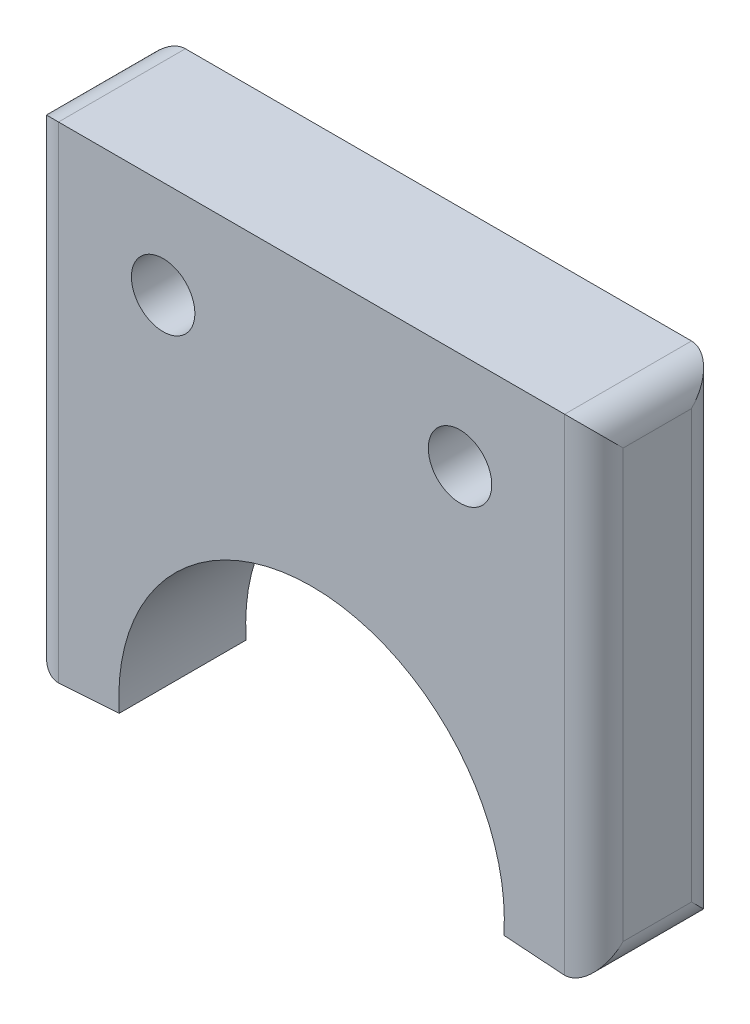
from build123d import *

# Parameters (mm, degrees)
SKETCH2_R           = 3.25
BOSS_EXTRUDE1_DEPTH = 13
FILLET1_R           = 3


with BuildPart() as part:
    # Sketch2 → Boss-Extrude1 (new body)
    with BuildSketch(Plane.XY):
        with BuildLine():
            Line((-19.701889993, -1.377690356), (-28.929357458, -2.022937739))
            Line((-28.929357458, -2.022937739), (-28.929357458, 47.977062261))
            Line((-28.929357458, 47.977062261), (28.929357458, 47.977062261))
            Line((28.929357458, 47.977062261), (28.929357458, -2.022937739))
            Line((28.929357458, -2.022937739), (19.701889993, -1.377690356))
            ThreePointArc((19.701889993, -1.377690356), (0, 19.75), (-19.701889993, -1.377690356))
        make_face()
        with Locations(Location((15.209921646, 37.977062261, 0), (0, 0, 180))):
            Circle(SKETCH2_R, mode=Mode.SUBTRACT)
        with Locations(Location((-15.209921646, 37.977062261, 0), (0, 0, 180))):
            Circle(SKETCH2_R, mode=Mode.SUBTRACT)
    extrude(amount=BOSS_EXTRUDE1_DEPTH)

    # Fillet1
    fillet1_edges = [part.edges().sort_by_distance(p)[0] for p in [
        (28.929357458, 22.977062261, 13),
        (-28.929357458, -2.022937739, 6.5),
        (-28.929357458, 47.977062261, 6.5),
        (28.929357458, 47.977062261, 6.5),
        (28.929357458, -2.022937739, 6.5),
        (-28.929357458, 22.977062261, 13),
        (-28.929357458, 22.977062261, 0),
        (28.929357458, 22.977062261, 0),
    ]]
    fillet(fillet1_edges, radius=FILLET1_R)


solid = part.part
